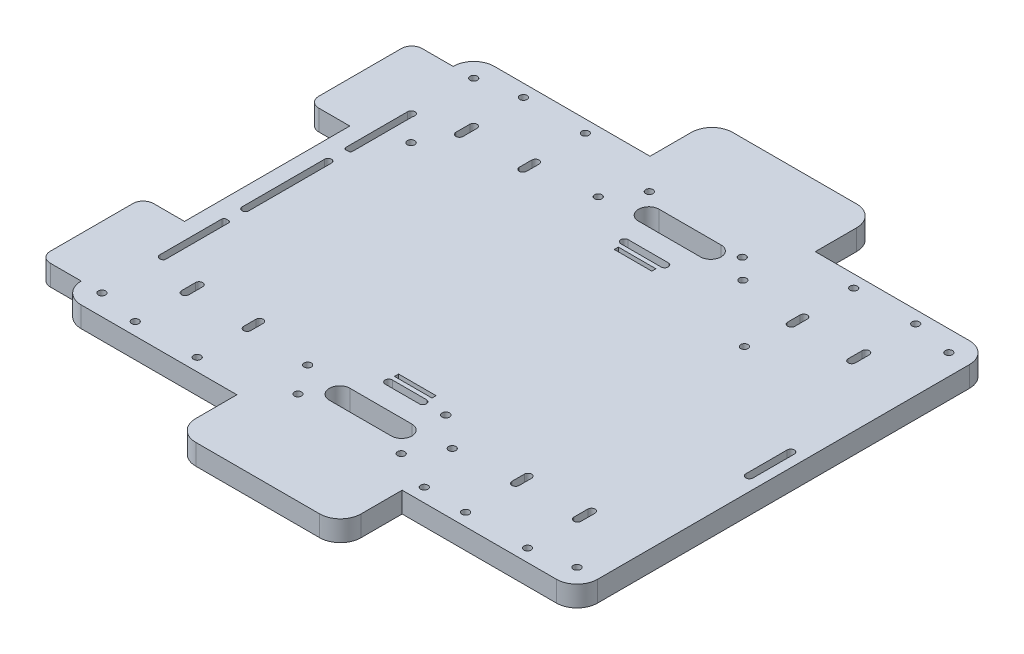
from build123d import *

# Parameters (mm, degrees)
SKETCH_1_R          = 1.75
SKETCH_1_R_2        = 1.8
EXTRUDE_1_DEPTH     = 10
SKETCH_2_W          = 18.155207679
SKETCH_2_H          = 2
CUT_EXTRUDE_1_DEPTH = 10


with BuildPart() as part:
    # 草图1 → 凸台-拉伸1 (new body)
    # profile 1 of 3: a face of its own
    with BuildSketch(Plane(origin=(0, 0, 0), x_dir=(1, 0, 0), z_dir=(0, 1, 0))):
        with BuildLine():
            Line((-39.453914906, 99.953224422), (-114.8, 99.953224422))
            ThreePointArc((-114.8, 99.953224422), (-121.871067812, 97.024292234), (-124.8, 89.953224422))
            Line((-124.8, 89.953224422), (-124.8, 39.953224422))
            Line((-124.8, 39.953224422), (-124.8, -40.046775578))
            Line((-124.8, -40.046775578), (-124.8, -90.046775578))
            ThreePointArc((-124.8, -90.046775578), (-121.871067812, -97.11784339), (-114.8, -100.046775578))
            Line((-114.8, -100.046775578), (-39.453914906, -100.046775578))
            Line((-39.453914906, -100.046775578), (-39.453914906, -119.953224422))
            ThreePointArc((-39.453914906, -119.953224422), (-36.524982718, -127.024292234), (-29.453914906, -129.953224422))
            Line((-29.453914906, -129.953224422), (30.546085094, -129.953224422))
            ThreePointArc((30.546085094, -129.953224422), (37.617152905, -127.024292234), (40.546085094, -119.953224422))
            Line((40.546085094, -119.953224422), (40.546085094, -100.046775578))
            Line((40.546085094, -100.046775578), (115.2, -100.046775578))
            ThreePointArc((115.2, -100.046775578), (122.271067812, -97.11784339), (125.2, -90.046775578))
            Line((125.2, -90.046775578), (125.2, 89.953224422))
            ThreePointArc((125.2, 89.953224422), (122.271067812, 97.024292234), (115.2, 99.953224422))
            Line((115.2, 99.953224422), (40.546085094, 99.953224422))
            Line((40.546085094, 99.953224422), (40.546085094, 119.953224422))
            ThreePointArc((40.546085094, 119.953224422), (37.617152905, 127.024292234), (30.546085094, 129.953224422))
            Line((30.546085094, 129.953224422), (-29.453914906, 129.953224422))
            ThreePointArc((-29.453914906, 129.953224422), (-36.524982718, 127.024292234), (-39.453914906, 119.953224422))
            Line((-39.453914906, 119.953224422), (-39.453914906, 99.953224422))
        make_face()
        with Locations(Location((-114.8, -90.046775578, 0), (0, 0, 270))):
            Circle(SKETCH_1_R, mode=Mode.SUBTRACT)
        with Locations(Location((-94.75, -93.953224422, 0), (0, 0, 270))):
            Circle(SKETCH_1_R, mode=Mode.SUBTRACT)
        with BuildLine():
            Line((-93, -63.013616334), (-93, -69.753224422))
            ThreePointArc((-93, -69.753224422), (-94.75, -71.503224422), (-96.5, -69.753224422))
            Line((-96.5, -69.753224422), (-96.5, -63.013616334))
            ThreePointArc((-96.5, -63.013616334), (-94.75, -61.263616334), (-93, -63.013616334))
        make_face(mode=Mode.SUBTRACT)
        with Locations(Location((-64.75, -93.953224422, 0), (0, 0, 270))):
            Circle(SKETCH_1_R, mode=Mode.SUBTRACT)
        with BuildLine():
            Line((-63, -63.73712587), (-63, -69.753224422))
            ThreePointArc((-63, -69.753224422), (-64.75, -71.503224422), (-66.5, -69.753224422))
            Line((-66.5, -69.753224422), (-66.5, -63.73712587))
            ThreePointArc((-66.5, -63.73712587), (-64.75, -61.98712587), (-63, -63.73712587))
        make_face(mode=Mode.SUBTRACT)
        with Locations(Location((-25, -84.953224422, 0), (0, 0, 270))):
            Circle(SKETCH_1_R, mode=Mode.SUBTRACT)
        with Locations(Location((-34.8, -70.440823307, 0), (0, 0, 270))):
            Circle(SKETCH_1_R, mode=Mode.SUBTRACT)
        with BuildLine():
            ThreePointArc((-116.8, -30), (-116.507106781, -29.292893219), (-115.8, -29))
            Line((-115.8, -29), (-114.5, -29))
            ThreePointArc((-114.5, -29), (-113.792893219, -29.292893219), (-113.5, -30))
            Line((-113.5, -30), (-113.5, -60.81240384))
            ThreePointArc((-113.5, -60.81240384), (-115.468330013, -61.699264547), (-116.8, -60))
            Line((-116.8, -60), (-116.8, -30))
        make_face(mode=Mode.SUBTRACT)
        with BuildLine():
            Line((15.2, -79.953224422), (-14.8, -79.953224422))
            ThreePointArc((-14.8, -79.953224422), (-19.8, -74.953224422), (-14.8, -69.953224422))
            Line((-14.8, -69.953224422), (15.2, -69.953224422))
            ThreePointArc((15.2, -69.953224422), (20.2, -74.953224422), (15.2, -79.953224422))
        make_face(mode=Mode.SUBTRACT)
        with Locations(Location((25, -84.953224422, 0), (0, 0, 270))):
            Circle(SKETCH_1_R, mode=Mode.SUBTRACT)
        with Locations(Location((44.646562072, -93.418550725, 0), (0, 0, 270))):
            Circle(SKETCH_1_R, mode=Mode.SUBTRACT)
        with Locations(Location((35.2, -70.440823307, 0), (0, 0, 270))):
            Circle(SKETCH_1_R, mode=Mode.SUBTRACT)
        with Locations(Location((65.15, -93.953224422, 0), (0, 0, 270))):
            Circle(SKETCH_1_R, mode=Mode.SUBTRACT)
        with BuildLine():
            ThreePointArc((66.9, -69.753224422), (65.15, -71.503224422), (63.4, -69.753224422))
            Line((63.4, -69.753224422), (63.4, -63.73712587))
            ThreePointArc((63.4, -63.73712587), (65.15, -61.98712587), (66.9, -63.73712587))
            Line((66.9, -63.73712587), (66.9, -69.753224422))
        make_face(mode=Mode.SUBTRACT)
        with Locations(Location((95.15, -93.953224422, 0), (0, 0, 270))):
            Circle(SKETCH_1_R, mode=Mode.SUBTRACT)
        with Locations(Location((115.2, -90.046775578, 0), (0, 0, 270))):
            Circle(SKETCH_1_R, mode=Mode.SUBTRACT)
        with BuildLine():
            ThreePointArc((96.9, -69.753224422), (95.15, -71.503224422), (93.4, -69.753224422))
            Line((93.4, -69.753224422), (93.4, -63.013616334))
            ThreePointArc((93.4, -63.013616334), (95.15, -61.263616334), (96.9, -63.013616334))
            Line((96.9, -63.013616334), (96.9, -69.753224422))
        make_face(mode=Mode.SUBTRACT)
        with BuildLine():
            ThreePointArc((-8.050679844, -59.703224422), (-9.800679844, -57.953224422), (-8.050679844, -56.203224422))
            Line((-8.050679844, -56.203224422), (8.450679844, -56.203224422))
            ThreePointArc((8.450679844, -56.203224422), (10.200679844, -57.953224422), (8.450679844, -59.703224422))
            Line((8.450679844, -59.703224422), (-8.050679844, -59.703224422))
        make_face(mode=Mode.SUBTRACT)
        with Locations(Location((19.6, -57.953224422, 0), (0, 0, 270))):
            Circle(SKETCH_1_R_2, mode=Mode.SUBTRACT)
        with BuildLine():
            ThreePointArc((-116.977491453, 20), (-115.327491453, 21.65), (-113.677491453, 20))
            Line((-113.677491453, 20), (-113.677491453, -20))
            ThreePointArc((-113.677491453, -20), (-115.327491453, -21.65), (-116.977491453, -20))
            Line((-116.977491453, -20), (-116.977491453, 20))
        make_face(mode=Mode.SUBTRACT)
        with BuildLine():
            ThreePointArc((-116.8, 60), (-114.631669987, 61.699264547), (-113.5, 59.18759616))
            Line((-113.5, 59.18759616), (-113.5, 30))
            ThreePointArc((-113.5, 30), (-113.792893219, 29.292893219), (-114.5, 29))
            Line((-114.5, 29), (-115.8, 29))
            ThreePointArc((-115.8, 29), (-116.507106781, 29.292893219), (-116.8, 30))
            Line((-116.8, 30), (-116.8, 60))
        make_face(mode=Mode.SUBTRACT)
        with Locations(Location((-103, 47.79226616, 0), (0, 0, 270))):
            Circle(SKETCH_1_R_2, mode=Mode.SUBTRACT)
        with Locations(Location((-114.8, 89.953224422, 0), (0, 0, 270))):
            Circle(SKETCH_1_R, mode=Mode.SUBTRACT)
        with BuildLine():
            ThreePointArc((-96.5, 69.753224422), (-94.75, 71.503224422), (-93, 69.753224422))
            Line((-93, 69.753224422), (-93, 63.013616334))
            ThreePointArc((-93, 63.013616334), (-94.75, 61.263616334), (-96.5, 63.013616334))
            Line((-96.5, 63.013616334), (-96.5, 69.753224422))
        make_face(mode=Mode.SUBTRACT)
        with Locations(Location((-94.75, 93.953224422, 0), (0, 0, 270))):
            Circle(SKETCH_1_R, mode=Mode.SUBTRACT)
        with BuildLine():
            ThreePointArc((-66.5, 69.753224422), (-64.75, 71.503224422), (-63, 69.753224422))
            Line((-63, 69.753224422), (-63, 63.73712587))
            ThreePointArc((-63, 63.73712587), (-64.75, 61.98712587), (-66.5, 63.73712587))
            Line((-66.5, 63.73712587), (-66.5, 69.753224422))
        make_face(mode=Mode.SUBTRACT)
        with Locations(Location((-64.75, 93.953224422, 0), (0, 0, 270))):
            Circle(SKETCH_1_R, mode=Mode.SUBTRACT)
        with Locations(Location((-35, 70.440823307, 0), (0, 0, 270))):
            Circle(SKETCH_1_R, mode=Mode.SUBTRACT)
        with Locations(Location((-24.8, 84.953224422, 0), (0, 0, 270))):
            Circle(SKETCH_1_R, mode=Mode.SUBTRACT)
        with BuildLine():
            ThreePointArc((-9.793175204, 56.203224422), (-11.543175204, 57.953224422), (-9.793175204, 59.703224422))
            Line((-9.793175204, 59.703224422), (9.637810035, 59.703224422))
            ThreePointArc((9.637810035, 59.703224422), (11.387810035, 57.953224422), (9.637810035, 56.203224422))
            Line((9.637810035, 56.203224422), (-9.793175204, 56.203224422))
        make_face(mode=Mode.SUBTRACT)
        with BuildLine():
            ThreePointArc((116.858925067, 10), (118.608925067, 11.75), (120.358925067, 10))
            Line((120.358925067, 10), (120.358925067, -10))
            ThreePointArc((120.358925067, -10), (118.608925067, -11.75), (116.858925067, -10))
            Line((116.858925067, -10), (116.858925067, 10))
        make_face(mode=Mode.SUBTRACT)
        with Locations(Location((63.165136033, 43, 0), (0, 0, 270))):
            Circle(SKETCH_1_R, mode=Mode.SUBTRACT)
        with BuildLine():
            ThreePointArc((-15.044800423, 69.953224422), (-20.044800423, 74.953224422), (-15.044800423, 79.953224422))
            Line((-15.044800423, 79.953224422), (14.955199577, 79.953224422))
            ThreePointArc((14.955199577, 79.953224422), (19.955199577, 74.953224422), (14.955199577, 69.953224422))
            Line((14.955199577, 69.953224422), (-15.044800423, 69.953224422))
        make_face(mode=Mode.SUBTRACT)
        with Locations(Location((35, 70.440823307, 0), (0, 0, 270))):
            Circle(SKETCH_1_R, mode=Mode.SUBTRACT)
        with Locations(Location((25.2, 79.953224422, 0), (0, 0, 270))):
            Circle(SKETCH_1_R, mode=Mode.SUBTRACT)
        with BuildLine():
            Line((63.4, 63.73712587), (63.4, 69.753224422))
            ThreePointArc((63.4, 69.753224422), (65.15, 71.503224422), (66.9, 69.753224422))
            Line((66.9, 69.753224422), (66.9, 63.73712587))
            ThreePointArc((66.9, 63.73712587), (65.15, 61.98712587), (63.4, 63.73712587))
        make_face(mode=Mode.SUBTRACT)
        with Locations(Location((65.15, 93.953224422, 0), (0, 0, 270))):
            Circle(SKETCH_1_R, mode=Mode.SUBTRACT)
        with BuildLine():
            Line((93.4, 63.013616334), (93.4, 69.753224422))
            ThreePointArc((93.4, 69.753224422), (95.15, 71.503224422), (96.9, 69.753224422))
            Line((96.9, 69.753224422), (96.9, 63.013616334))
            ThreePointArc((96.9, 63.013616334), (95.15, 61.263616334), (93.4, 63.013616334))
        make_face(mode=Mode.SUBTRACT)
        with Locations(Location((95.15, 93.953224422, 0), (0, 0, 270))):
            Circle(SKETCH_1_R, mode=Mode.SUBTRACT)
        with Locations(Location((115.2, 89.953224422, 0), (0, 0, 270))):
            Circle(SKETCH_1_R, mode=Mode.SUBTRACT)
    # profile 2 of 3: a face of its own
    with BuildSketch(Plane(origin=(0, 0, 0), x_dir=(1, 0, 0), z_dir=(0, 1, 0))):
        with BuildLine():
            Line((-124.8, 39.953224422), (-124.8, 89.953224422))
            Line((-124.8, 89.953224422), (-139.8, 89.953224422))
            ThreePointArc((-139.8, 89.953224422), (-143.335533906, 88.488758328), (-144.8, 84.953224422))
            Line((-144.8, 84.953224422), (-144.8, 44.953224422))
            ThreePointArc((-144.8, 44.953224422), (-143.335533906, 41.417690516), (-139.8, 39.953224422))
            Line((-139.8, 39.953224422), (-124.8, 39.953224422))
        make_face()
    # profile 3 of 3: a face of its own
    with BuildSketch(Plane(origin=(0, 0, 0), x_dir=(1, 0, 0), z_dir=(0, 1, 0))):
        with BuildLine():
            Line((-124.8, -90.046775578), (-124.8, -40.046775578))
            Line((-124.8, -40.046775578), (-139.8, -40.046775578))
            ThreePointArc((-139.8, -40.046775578), (-143.335533906, -41.511241672), (-144.8, -45.046775578))
            Line((-144.8, -45.046775578), (-144.8, -85.046775578))
            ThreePointArc((-144.8, -85.046775578), (-143.335533906, -88.582309484), (-139.8, -90.046775578))
            Line((-139.8, -90.046775578), (-124.8, -90.046775578))
        make_face()
    extrude(amount=EXTRUDE_1_DEPTH)

    # 草图2 → 切除-拉伸1 (cut)
    with BuildSketch(Plane(origin=(0, 10, 0), x_dir=(1, 0, 0), z_dir=(0, 1, 0))):
        with Locations((0.054789132, -53.203224422)):
            Rectangle(SKETCH_2_W, SKETCH_2_H)
        with Locations((0.054789132, 53.203224422)):
            Rectangle(SKETCH_2_W, SKETCH_2_H)
    extrude(amount=-CUT_EXTRUDE_1_DEPTH, mode=Mode.SUBTRACT)


solid = part.part
